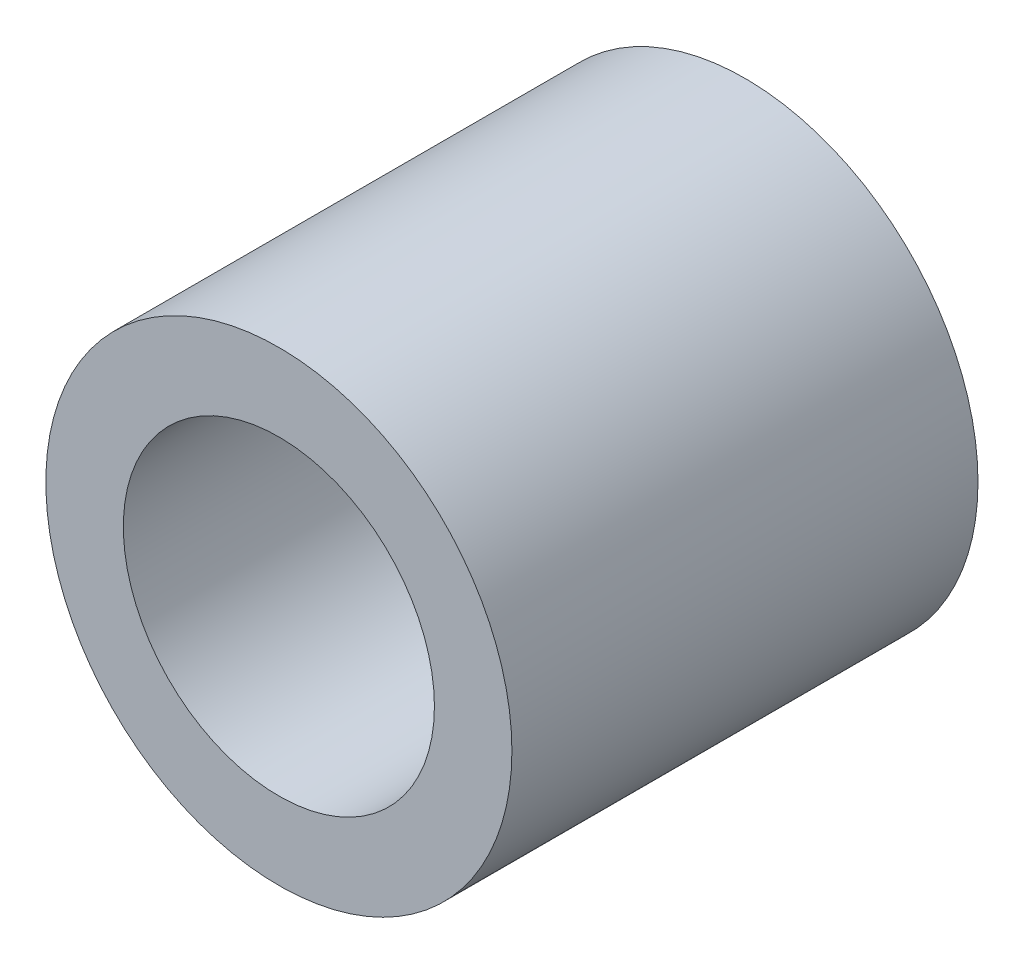
from build123d import *

# Parameters (mm, degrees)
BOSS_EXTRUDE1_DEPTH      = 4.7625
BOSS_EXTRUDE1_DEPTH_BACK = 4.7625
SKETCH3_R                = 4.7625
SKETCH3_R_2              = 3.17881


with BuildPart() as part:
    # Sketch3 → Boss-Extrude1 (new, two sides: drawn at the far end of the back side and taken through both)
    with BuildSketch(Plane.XY.offset(-BOSS_EXTRUDE1_DEPTH_BACK)):
        Circle(SKETCH3_R)
        Circle(SKETCH3_R_2, mode=Mode.SUBTRACT)
    extrude(amount=BOSS_EXTRUDE1_DEPTH + BOSS_EXTRUDE1_DEPTH_BACK)


solid = part.part
